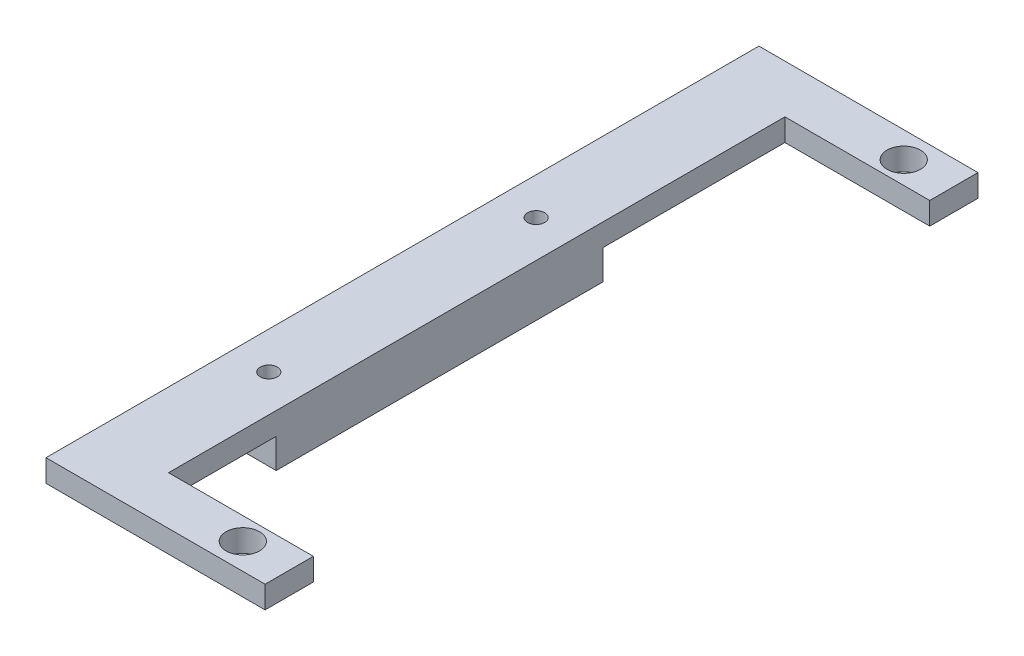
from build123d import *

# Parameters (mm, degrees)
SKETCH_1_W      = 10
SKETCH_1_H      = 44
SKETCH_1_R      = 1.15
EXTRUDE_1_DEPTH = 4
SKETCH_2_R      = 2.25
SKETCH_2_R_2    = 1.15
EXTRUDE_2_DEPTH = 3


with BuildPart() as part:
    # 草图1 → 凸台-拉伸1 (new body)
    with BuildSketch(Plane(origin=(0, 0, 0), x_dir=(1, 0, 0), z_dir=(0, 1, 0))):
        Rectangle(SKETCH_1_W, SKETCH_1_H)
        with Locations(Location((0, -18, 0), (0, 0, 270))):
            Circle(SKETCH_1_R, mode=Mode.SUBTRACT)
        with Locations(Location((0, 18, 0), (0, 0, 270))):
            Circle(SKETCH_1_R, mode=Mode.SUBTRACT)
    extrude(amount=EXTRUDE_1_DEPTH)

    # 草图2 → 凸台-拉伸2 (add)
    # profile 1 of 3: a face of its own
    with BuildSketch(Plane(origin=(0, 4, 0), x_dir=(1, 0, 0), z_dir=(0, 1, 0))):
        Polygon((-5, 32), (-5, 22), (5, 22), (5, 32), (5, 46.5), (24.5, 46.5), (24.5, 53), (-5, 53), (-5, 45.896329407), align=None)
        with Locations(Location((18, 49.5, 0), (0, 0, 270))):
            Circle(SKETCH_2_R, mode=Mode.SUBTRACT)
    # profile 2 of 3: a face of its own
    with BuildSketch(Plane(origin=(0, 4, 0), x_dir=(1, 0, 0), z_dir=(0, 1, 0))):
        Polygon((-5, -12), (-5, -22), (5, -22), (5, -12), (5, 22), (-5, 22), align=None)
        with Locations(Location((0, -18, 0), (0, 0, 270))):
            Circle(SKETCH_2_R_2, mode=Mode.SUBTRACT)
        with Locations(Location((0, 18, 0), (0, 0, 270))):
            Circle(SKETCH_2_R_2, mode=Mode.SUBTRACT)
    # profile 3 of 3: a face of its own
    with BuildSketch(Plane(origin=(0, 4, 0), x_dir=(1, 0, 0), z_dir=(0, 1, 0))):
        Polygon((24.5, -36.5), (5, -36.5), (5, -22), (-5, -22), (-5, -43), (24.5, -43), align=None)
        with Locations(Location((18, -39.5, 0), (0, 0, 270))):
            Circle(SKETCH_2_R, mode=Mode.SUBTRACT)
    extrude(amount=EXTRUDE_2_DEPTH)


solid = part.part
